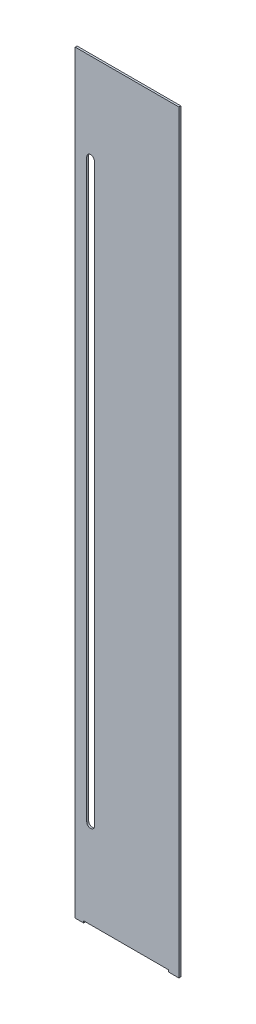
from build123d import *

# Parameters (mm, degrees)
SKETCH1_W                    = 270
SKETCH1_H                    = 1965
MAIN_PLATE_EXTRUDE_DEPTH     = 5
MOTOR_MOUNT_CUT_DEPTH        = 992.7440446
MOTOR_MOUNT_CUT_DEPTH_BACK   = 992.7440446
SKETCH2_W                    = 221
SKETCH2_H                    = 5
OUTPUT_SHAFT_SLOT_DEPTH      = 992.7440446
OUTPUT_SHAFT_SLOT_DEPTH_BACK = 992.7440446


with BuildPart() as part:
    # Sketch1 → Main plate extrude (new body)
    with BuildSketch(Plane.XY):
        Rectangle(SKETCH1_W, SKETCH1_H)
    extrude(amount=MAIN_PLATE_EXTRUDE_DEPTH)

    # Sketch2 → Motor mount cut (cut, two sides: drawn at the far end of the back side and taken through both)
    with BuildSketch(Plane.XY.offset(5).offset(-MOTOR_MOUNT_CUT_DEPTH_BACK)):
        with Locations((-2.5, -980)):
            Rectangle(SKETCH2_W, SKETCH2_H)
    extrude(amount=MOTOR_MOUNT_CUT_DEPTH + MOTOR_MOUNT_CUT_DEPTH_BACK, mode=Mode.SUBTRACT)

    # Sketch3 → Output shaft slot (cut, two sides: drawn at the far end of the back side and taken through both)
    with BuildSketch(Plane.XY.offset(5).offset(-OUTPUT_SHAFT_SLOT_DEPTH_BACK)):
        with BuildLine():
            Line((-85, 750), (-85, -750))
            ThreePointArc((-85, -750), (-95, -760), (-105, -750))
            Line((-105, -750), (-105, 750))
            ThreePointArc((-105, 750), (-95, 760), (-85, 750))
        make_face()
    extrude(amount=OUTPUT_SHAFT_SLOT_DEPTH + OUTPUT_SHAFT_SLOT_DEPTH_BACK, mode=Mode.SUBTRACT)


solid = part.part
